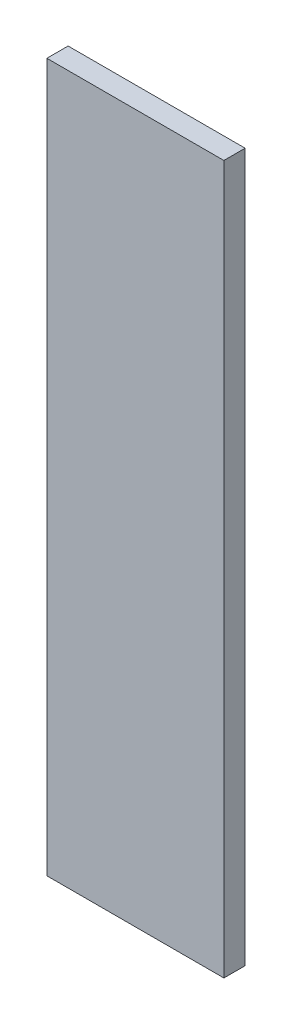
from build123d import *

# Parameters (mm, degrees)
WINGSKETCH_W          = 1000
WINGSKETCH_H          = 120
RECTANGUALRWING_DEPTH = 2000


with BuildPart() as part:
    # WingSketch → RectangualrWing (new, symmetric)
    with BuildSketch(Plane(origin=(0, 0, 0), x_dir=(1, 0, 0), z_dir=(0, 1, 0))):
        Rectangle(WINGSKETCH_W, WINGSKETCH_H)
    extrude(amount=RECTANGUALRWING_DEPTH, both=True)


solid = part.part
